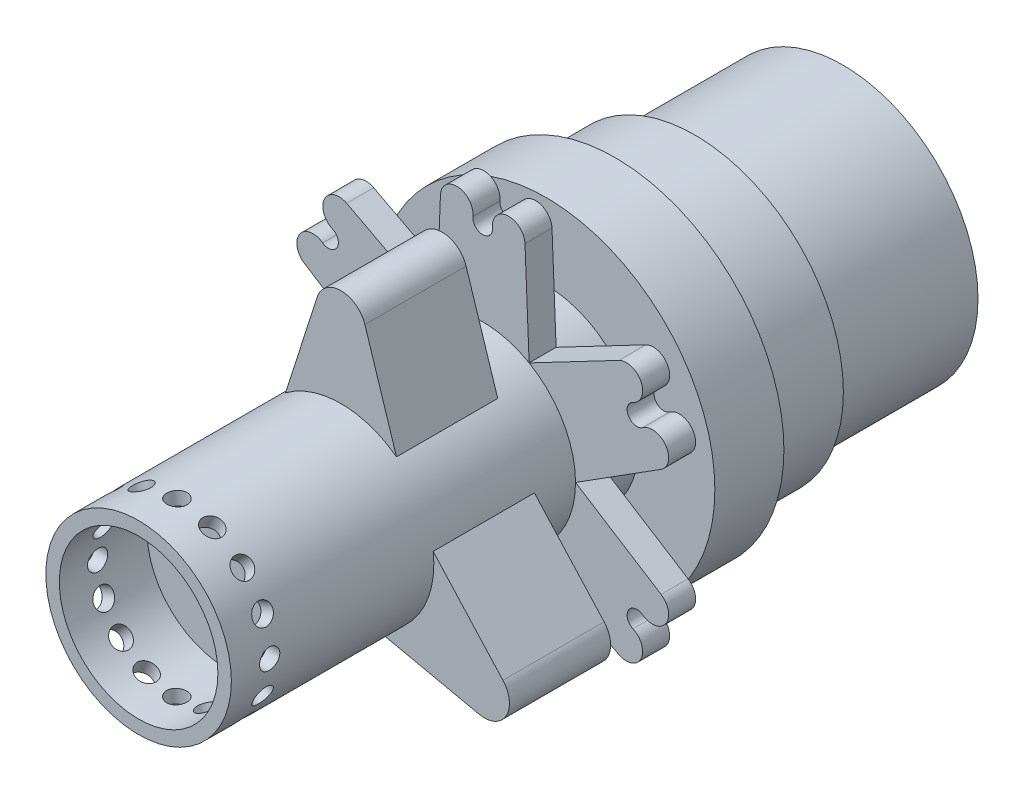
from build123d import *

# Parameters (mm, degrees)
SKETCH1_R               = 17.4625
BOSS_EXTRUDE1_DEPTH     = 132.588
BOSS_EXTRUDE2_START     = -19.05
BOSS_EXTRUDE2_DEPTH     = 19.05
BOSS_EXTRUDE3_DEPTH     = 5.08
SKETCH5_R               = 14.9225
CUT_EXTRUDE1_DEPTH      = 16.51
CUT_EXTRUDE2_REACH      = 144.06
CUT_EXTRUDE2_END_RADIUS = 17.4625
SKETCH7_R               = 1.905
CIRPATTERN1_COUNT       = 16
SKETCH8_R               = 31.75
BOSS_EXTRUDE4_DEPTH     = 13
BOSS_EXTRUDE5_START     = 42.88
SKETCH9_R               = 27.94
BOSS_EXTRUDE5_DEPTH     = 15
SKETCH10_R              = 25.4
BOSS_EXTRUDE6_DEPTH     = 27.88


with BuildPart() as part:
    # Sketch1 → Boss-Extrude1 (new body)
    with BuildSketch(Plane.XY):
        Circle(SKETCH1_R)
    extrude(amount=BOSS_EXTRUDE1_DEPTH)

    # Sketch3 → Boss-Extrude2 (add)
    with BuildSketch(Plane.XY.offset(94.488).offset(BOSS_EXTRUDE2_START)):
        with BuildLine():
            ThreePointArc((6.899896811, -16.041518951), (15.122968614, -8.73125), (17.342311332, 2.045273553))
            Line((17.342311332, 2.045273553), (30.466739664, -12.40584776))
            ThreePointArc((30.466739664, -12.40584776), (31.059563562, -17.932247383), (25.977149147, -20.182046639))
            Line((25.977149147, -20.182046639), (6.899896811, -16.041518951))
        make_face()
        with BuildLine():
            ThreePointArc((10.442414521, 13.996245398), (0, 17.4625), (-10.442414521, 13.996245398))
            Line((-10.442414521, 13.996245398), (-4.489590516, 32.587894399))
            ThreePointArc((-4.489590516, 32.587894399), (0, 35.864494767), (4.489590516, 32.587894399))
            Line((4.489590516, 32.587894399), (10.442414521, 13.996245398))
        make_face()
        with BuildLine():
            Line((-17.342311332, 2.045273553), (-30.466739664, -12.40584776))
            ThreePointArc((-30.466739664, -12.40584776), (-31.059563562, -17.932247383), (-25.977149147, -20.182046639))
            Line((-25.977149147, -20.182046639), (-6.899896811, -16.041518951))
            ThreePointArc((-6.899896811, -16.041518951), (-15.122968614, -8.73125), (-17.342311332, 2.045273553))
        make_face()
    extrude(amount=BOSS_EXTRUDE2_DEPTH)

    # Sketch4 → Boss-Extrude3 (add)
    with BuildSketch(Plane.XY.offset(62.738)):
        with BuildLine():
            Line((8.73125, 15.122968614), (7.956920991, 34.16216406))
            ThreePointArc((7.956920991, 34.16216406), (4.663249673, 37.098547927), (1.838074046, 33.709004648))
            ThreePointArc((1.838074046, 33.709004648), (0, 31.662515578), (-1.838074046, 33.709004648))
            ThreePointArc((-1.838074046, 33.709004648), (-4.663249673, 37.098547927), (-7.956920991, 34.16216406))
            Line((-7.956920991, 34.16216406), (-8.73125, 15.122968614))
            Line((-8.73125, 15.122968614), (-25.606841428, 23.971977744))
            ThreePointArc((-25.606841428, 23.971977744), (-29.796660112, 22.587766645), (-28.273817338, 18.446321142))
            ThreePointArc((-28.273817338, 18.446321142), (-27.420542838, 15.831257789), (-30.111891384, 15.262683506))
            ThreePointArc((-30.111891384, 15.262683506), (-34.459909785, 14.510781282), (-33.56376242, 10.190186315))
            Line((-33.56376242, 10.190186315), (-17.4625, 0))
            Line((-17.4625, 0), (-33.56376242, -10.190186315))
            ThreePointArc((-33.56376242, -10.190186315), (-34.459909785, -14.510781282), (-30.111891384, -15.262683506))
            ThreePointArc((-30.111891384, -15.262683506), (-27.420542838, -15.831257789), (-28.273817338, -18.446321142))
            ThreePointArc((-28.273817338, -18.446321142), (-29.796660112, -22.587766645), (-25.606841428, -23.971977744))
            Line((-25.606841428, -23.971977744), (-8.73125, -15.122968614))
            Line((-8.73125, -15.122968614), (-7.956920991, -34.16216406))
            ThreePointArc((-7.956920991, -34.16216406), (-4.663249673, -37.098547927), (-1.838074046, -33.709004648))
            ThreePointArc((-1.838074046, -33.709004648), (0, -31.662515578), (1.838074046, -33.709004648))
            ThreePointArc((1.838074046, -33.709004648), (4.663249673, -37.098547927), (7.956920991, -34.16216406))
            Line((7.956920991, -34.16216406), (8.73125, -15.122968614))
            Line((8.73125, -15.122968614), (25.606841428, -23.971977744))
            ThreePointArc((25.606841428, -23.971977744), (29.796660112, -22.587766645), (28.273817338, -18.446321142))
            ThreePointArc((28.273817338, -18.446321142), (27.420542838, -15.831257789), (30.111891384, -15.262683506))
            ThreePointArc((30.111891384, -15.262683506), (34.459909785, -14.510781282), (33.56376242, -10.190186315))
            Line((33.56376242, -10.190186315), (17.4625, 0))
            Line((17.4625, 0), (33.56376242, 10.190186315))
            ThreePointArc((33.56376242, 10.190186315), (34.459909785, 14.510781282), (30.111891384, 15.262683506))
            ThreePointArc((30.111891384, 15.262683506), (27.420542838, 15.831257789), (28.273817338, 18.446321142))
            ThreePointArc((28.273817338, 18.446321142), (29.796660112, 22.587766645), (25.606841428, 23.971977744))
            Line((25.606841428, 23.971977744), (8.73125, 15.122968614))
        make_face()
    extrude(amount=BOSS_EXTRUDE3_DEPTH)

    # Sketch5 → Cut-Extrude1 (cut)
    with BuildSketch(Plane.XY.offset(132.588)):
        Circle(SKETCH5_R)
    extrude(amount=-CUT_EXTRUDE1_DEPTH, mode=Mode.SUBTRACT)

    # Cut-Extrude2: up to this cylinder (the profile starts inside it)
    cut_extrude2_end = Plane(origin=(0, 0, 125.378708), z_dir=(0, 0, -1)) * Cylinder(CUT_EXTRUDE2_END_RADIUS, 324.045, mode=Mode.PRIVATE)
    # Sketch7 → Cut-Extrude2 (cut, up to the surface)
    with BuildSketch(Plane(origin=(0, 0, 0), x_dir=(1, 0, 0), z_dir=(0, 1, 0)), mode=Mode.PRIVATE) as cut_extrude2_sk1:
        with Locations(Location((0, -125.378708066, 0), (0, 0, 90))):
            Circle(SKETCH7_R)
    cut_extrude2_tool1 = extrude(cut_extrude2_sk1.sketch, amount=CUT_EXTRUDE2_REACH, mode=Mode.PRIVATE) & cut_extrude2_end
    cut_extrude2 = cut_extrude2_tool1.solids().sort_by_distance((0, 0, 125.378708))[0]
    add(cut_extrude2, mode=Mode.SUBTRACT)

    # CirPattern1: Cut-Extrude2 ×16 about axis
    cirpattern1_axis = Axis((0, 0, 187.077696833), (0, 0, -1))
    for i in range(1, CIRPATTERN1_COUNT):
        add(cut_extrude2.rotate(cirpattern1_axis, i * 360 / CIRPATTERN1_COUNT), mode=Mode.SUBTRACT)

    # Sketch8 → Boss-Extrude4 (add)
    with BuildSketch(Plane.XY.offset(55.88)):
        Circle(SKETCH8_R)
    extrude(amount=-BOSS_EXTRUDE4_DEPTH)

    # Sketch9 → Boss-Extrude5 (add)
    with BuildSketch(Plane.XY.offset(BOSS_EXTRUDE5_START)):
        Circle(SKETCH9_R)
    extrude(amount=-BOSS_EXTRUDE5_DEPTH)

    # Sketch10 → Boss-Extrude6 (add)
    with BuildSketch(Plane.XY):
        Circle(SKETCH10_R)
    extrude(amount=BOSS_EXTRUDE6_DEPTH)


solid = part.part
